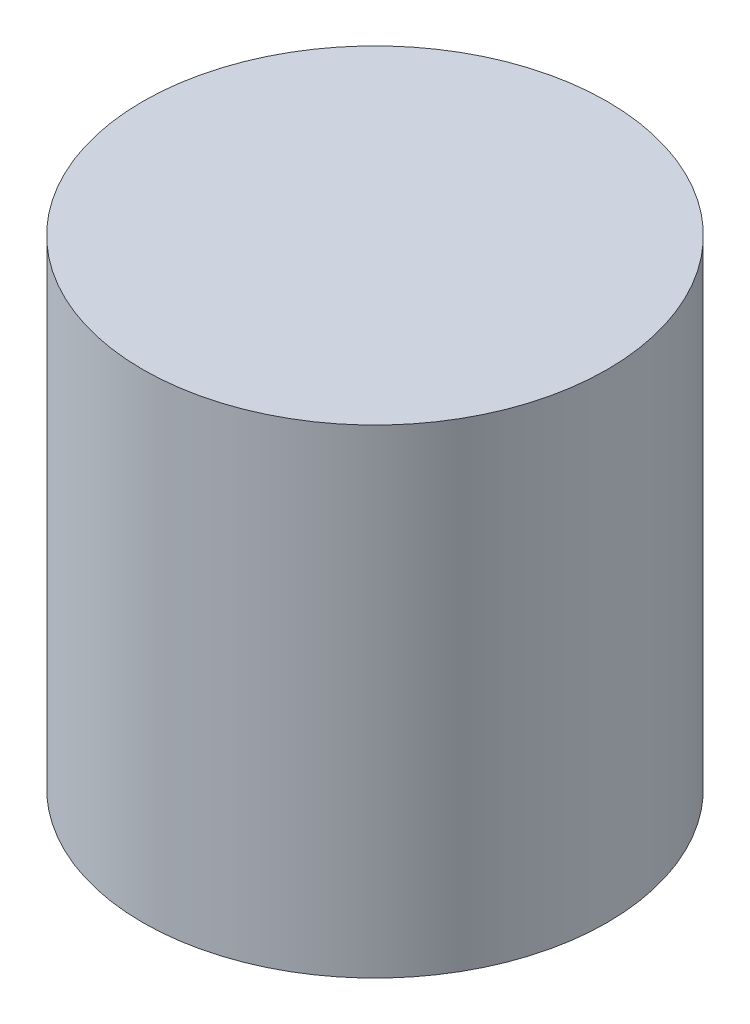
from build123d import *

# Parameters (mm, degrees)
SKETCH2_R           = 32
BOSS_EXTRUDE1_DEPTH = 66


with BuildPart() as part:
    # Sketch2 → Boss-Extrude1 (new body)
    with BuildSketch(Plane(origin=(0, 0, 0), x_dir=(1, 0, 0), z_dir=(0, 1, 0))):
        with Locations(Location((0, 0, 0), (0, 0, 270))):
            Circle(SKETCH2_R)
    extrude(amount=BOSS_EXTRUDE1_DEPTH)


solid = part.part
